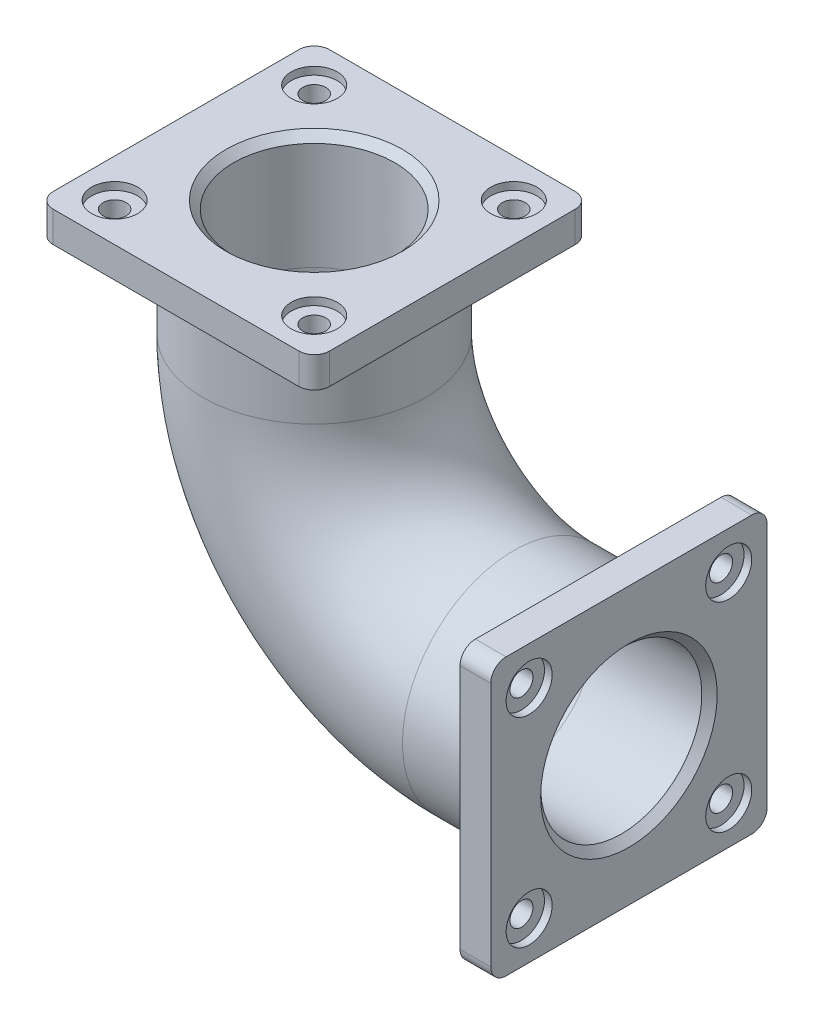
from build123d import *

# Parameters (mm, degrees)
SKETCH2_R           = 145
SKETCH2_R_2         = 105
BOSS_EXTRUDE1_START = -40
SKETCH3_W           = 360
SKETCH3_H           = 360
SKETCH3_R           = 145
BOSS_EXTRUDE1_DEPTH = 40
SKETCH4_W           = 360
SKETCH4_H           = 360
SKETCH4_R           = 145
BOSS_EXTRUDE2_DEPTH = 40
FILLET1_R           = 20
CHAMFER1_SIZE       = 10
SKETCH5_R           = 30
CUT_EXTRUDE1_DEPTH  = 10
CUT_EXTRUDE2_REACH  = 734.735
SKETCH6_R           = 15
CIRPATTERN1_COUNT   = 4
SKETCH7_R           = 30
CUT_EXTRUDE3_DEPTH  = 10
CUT_EXTRUDE4_REACH  = 848.699
SKETCH8_R           = 15
CIRPATTERN2_COUNT   = 4


with BuildPart() as part:
    # Sweep-Thin1: sweep along a path in Sketch1
    with BuildLine(Plane.XY) as sweep_thin1_path:
        Line((0, 0), (-150, 0))
        ThreePointArc((-150, 0), (-333.847763109, 76.152236891), (-410, 260))
        Line((-410, 260), (-410, 410))
    # Sketch2 → Sweep-Thin1 (sweep)
    with BuildSketch(Plane(origin=(0, 0, 0), x_dir=(0, 0, -1), z_dir=(1, 0, 0))):
        Circle(SKETCH2_R)
        Circle(SKETCH2_R_2, mode=Mode.SUBTRACT)
    sweep(path=sweep_thin1_path.line)

    # Sketch3 → Boss-Extrude1 (add)
    with BuildSketch(Plane(origin=(0, 0, 0), x_dir=(0, 0, -1), z_dir=(1, 0, 0)).offset(BOSS_EXTRUDE1_START)):
        Rectangle(SKETCH3_W, SKETCH3_H)
        with Locations(Location((0, 0, 0), (0, 0, 270))):
            Circle(SKETCH3_R, mode=Mode.SUBTRACT)
    extrude(amount=BOSS_EXTRUDE1_DEPTH)

    # Sketch4 → Boss-Extrude2 (add)
    with BuildSketch(Plane(origin=(0, 410, 0), x_dir=(1, 0, 0), z_dir=(0, 1, 0))):
        with Locations((-410, 0)):
            Rectangle(SKETCH4_W, SKETCH4_H)
        with Locations(Location((-410, 0, 0), (0, 0, 180))):
            Circle(SKETCH4_R, mode=Mode.SUBTRACT)
    extrude(amount=-BOSS_EXTRUDE2_DEPTH)

    # Fillet1
    fillet1_edges = [part.edges().sort_by_distance(p)[0] for p in [
        (-20, 180, -180),
        (-20, -180, -180),
        (-20, -180, 180),
        (-20, 180, 180),
        (-230, 390, -180),
        (-230, 390, 180),
        (-590, 390, 180),
        (-590, 390, -180),
    ]]
    fillet(fillet1_edges, radius=FILLET1_R)

    # Chamfer1
    chamfer1_edges = [part.edges().sort_by_distance(p)[0] for p in [
        (0, 0, 105),
        (-410, 410, 105),
    ]]
    chamfer(chamfer1_edges, length=CHAMFER1_SIZE)

    # Sketch5 → Cut-Extrude1 (cut)
    with BuildSketch(Plane(origin=(0, 0, 0), x_dir=(0, 0, -1), z_dir=(1, 0, 0))):
        with Locations((-130, 130)):
            Circle(SKETCH5_R)
    cut_extrude1 = extrude(amount=-CUT_EXTRUDE1_DEPTH, mode=Mode.SUBTRACT)

    # Sketch6 → Cut-Extrude2 (cut, up to next)
    with BuildSketch(Plane(origin=(-10, 0, 0), x_dir=(0, 0, -1), z_dir=(1, 0, 0)), mode=Mode.PRIVATE) as cut_extrude2_sk1:
        with Locations((-130, 130)):
            Circle(SKETCH6_R)
    cut_extrude2_tool1 = extrude(cut_extrude2_sk1.sketch, amount=-CUT_EXTRUDE2_REACH, mode=Mode.PRIVATE) & part.part
    cut_extrude2 = cut_extrude2_tool1.solids().sort_by_distance((-10, 130, 130))[0]
    add(cut_extrude2, mode=Mode.SUBTRACT)

    # CirPattern1: Cut-Extrude1, Cut-Extrude2 ×4 about axis
    cirpattern1_axis = Axis((0, 0, 0), (1, 0, 0))
    add([cut_extrude1.rotate(cirpattern1_axis, i * 360 / CIRPATTERN1_COUNT) for i in range(1, CIRPATTERN1_COUNT)], mode=Mode.SUBTRACT)
    add([cut_extrude2.rotate(cirpattern1_axis, i * 360 / CIRPATTERN1_COUNT) for i in range(1, CIRPATTERN1_COUNT)], mode=Mode.SUBTRACT)

    # Sketch7 → Cut-Extrude3 (cut)
    with BuildSketch(Plane(origin=(0, 410, 0), x_dir=(1, 0, 0), z_dir=(0, 1, 0))):
        with Locations(Location((-540, 130, 0), (0, 0, 180))):
            Circle(SKETCH7_R)
    cut_extrude3 = extrude(amount=-CUT_EXTRUDE3_DEPTH, mode=Mode.SUBTRACT)

    # Sketch8 → Cut-Extrude4 (cut, up to next)
    with BuildSketch(Plane(origin=(0, 400, 0), x_dir=(1, 0, 0), z_dir=(0, 1, 0)), mode=Mode.PRIVATE) as cut_extrude4_sk1:
        with Locations(Location((-540, 130, 0), (0, 0, 180))):
            Circle(SKETCH8_R)
    cut_extrude4_tool1 = extrude(cut_extrude4_sk1.sketch, amount=-CUT_EXTRUDE4_REACH, mode=Mode.PRIVATE) & part.part
    cut_extrude4 = cut_extrude4_tool1.solids().sort_by_distance((-540, 400, -130))[0]
    add(cut_extrude4, mode=Mode.SUBTRACT)

    # CirPattern2: Cut-Extrude3, Cut-Extrude4 ×4 about axis
    cirpattern2_axis = Axis((-410, 0, 0), (0, 1, 0))
    add([cut_extrude3.rotate(cirpattern2_axis, i * 360 / CIRPATTERN2_COUNT) for i in range(1, CIRPATTERN2_COUNT)], mode=Mode.SUBTRACT)
    add([cut_extrude4.rotate(cirpattern2_axis, i * 360 / CIRPATTERN2_COUNT) for i in range(1, CIRPATTERN2_COUNT)], mode=Mode.SUBTRACT)


solid = part.part
